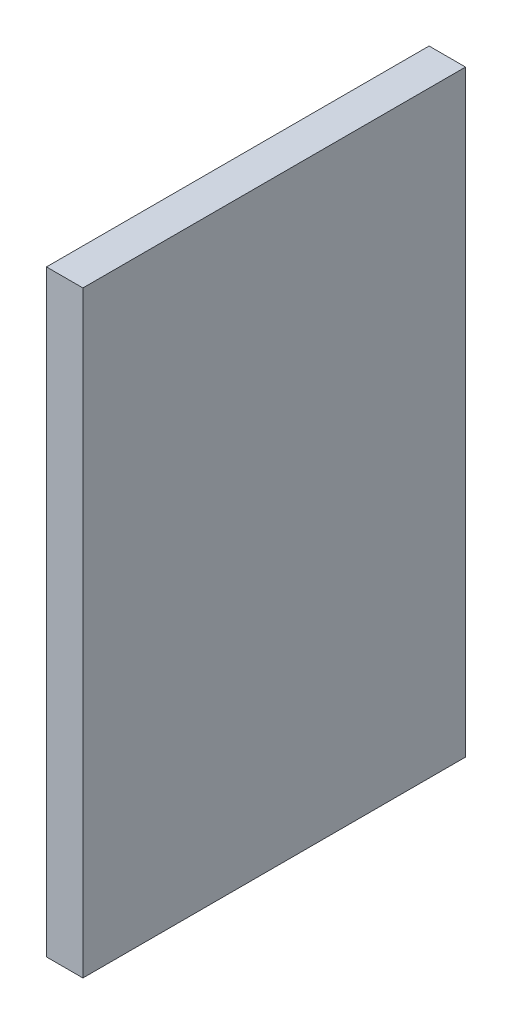
from build123d import *

# Parameters (mm, degrees)
SKETCH1_W           = 38.1
SKETCH1_H           = 400.05
BOSS_EXTRUDE1_DEPTH = 312.42


with BuildPart() as part:
    # Sketch1 → Boss-Extrude1 (new, symmetric)
    with BuildSketch(Plane(origin=(0, 0, 0), x_dir=(1, 0, 0), z_dir=(0, 1, 0))):
        with Locations((0, -12.7)):
            Rectangle(SKETCH1_W, SKETCH1_H)
    extrude(amount=BOSS_EXTRUDE1_DEPTH, both=True)


solid = part.part
